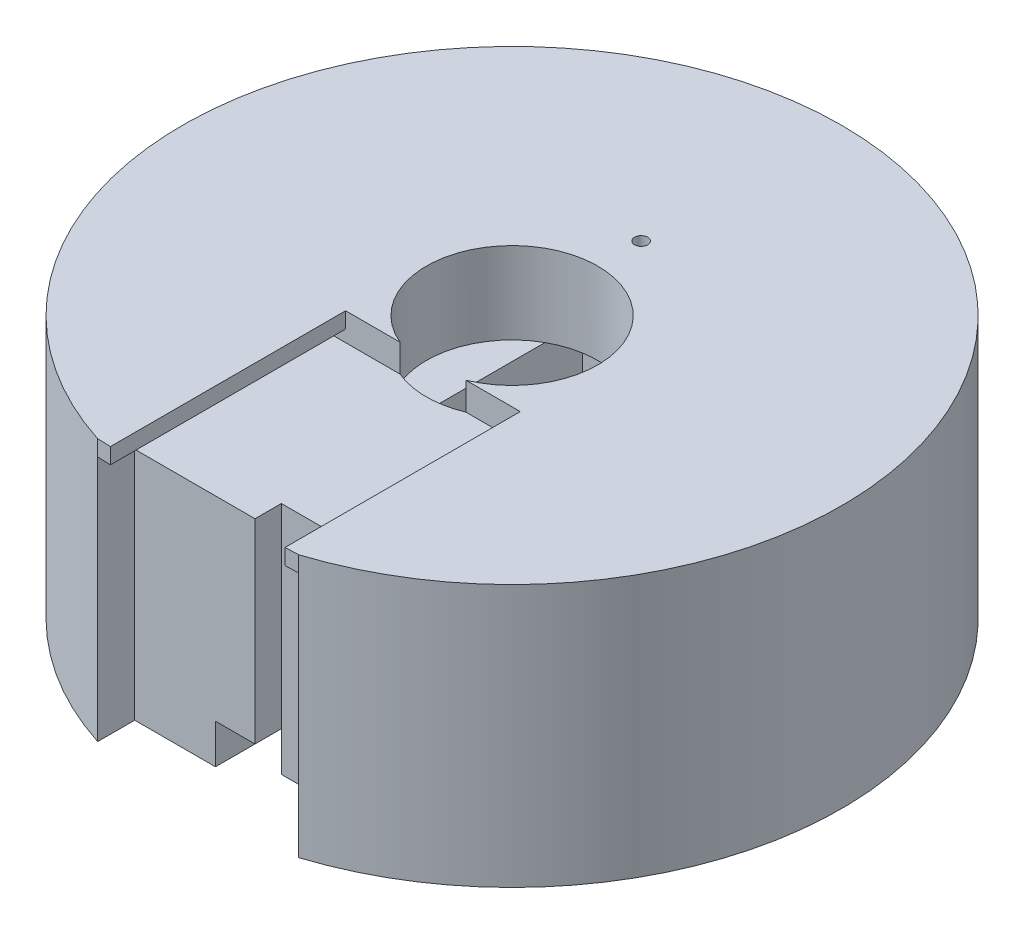
from build123d import *
from build123d.topology import SkipClean

# Parameters (mm, degrees)
SKETCH7_R            = 50
SKETCH7_W            = 12.7
SKETCH7_H            = 33.05
BOSS_EXTRUDE4_DEPTH  = 19.2
SKETCH8_R            = 50
SKETCH8_W            = 12.7
SKETCH8_H            = 23.2
BOSS_EXTRUDE5_DEPTH  = 8.2
SKETCH11_R           = 50
SKETCH11_R_2         = 13
BOSS_EXTRUDE6_DEPTH  = 8.2
SKETCH12_R           = 1
CUT_EXTRUDE4_DEPTH   = 74.271003815
SKETCH13_W           = 30.5
SKETCH13_H           = 8
CUT_EXTRUDE5_DEPTH   = 35.6
CUT_EXTRUDE6_DEPTH   = 6
SKETCH15_W           = 12.25
SKETCH15_H           = 4
CUT_EXTRUDE7_DEPTH   = 29.6
SKETCH16_R           = 1
BOSS_EXTRUDE11_DEPTH = 5.2
CUT_EXTRUDE8_START   = -1
SKETCH20_R           = 50
CUT_EXTRUDE8_DEPTH   = 1
BOSS_EXTRUDE12_DEPTH = 2.4


with BuildPart() as part:
    # Sketch7 → Boss-Extrude4 (new body)
    with BuildSketch(Plane(origin=(0, 0, 0), x_dir=(1, 0, 0), z_dir=(0, 1, 0))):
        with Locations(Location((0, 0, 0), (0, 0, 270))):
            Circle(SKETCH7_R)
        with Locations((0, 5.455)):
            Rectangle(SKETCH7_W, SKETCH7_H, mode=Mode.SUBTRACT)
    extrude(amount=BOSS_EXTRUDE4_DEPTH)

    # Sketch8 → Boss-Extrude5 (add)
    with BuildSketch(Plane(origin=(0, 19.2, 0), x_dir=(1, 0, 0), z_dir=(0, 1, 0))):
        with Locations(Location((0, 0, 0), (0, 0, 270))):
            Circle(SKETCH8_R)
        with Locations((0, 5.455)):
            Rectangle(SKETCH8_W, SKETCH8_H, mode=Mode.SUBTRACT)
    extrude(amount=BOSS_EXTRUDE5_DEPTH)

    # Sketch11 → Boss-Extrude6 (add)
    with BuildSketch(Plane(origin=(0, 27.4, 0), x_dir=(1, 0, 0), z_dir=(0, 1, 0))):
        with Locations(Location((0, 0, 0), (0, 0, 270))):
            Circle(SKETCH11_R)
        with Locations(Location((0, 0, 0), (0, 0, 119.239513028))):
            Circle(SKETCH11_R_2, mode=Mode.SUBTRACT)
    extrude(amount=BOSS_EXTRUDE6_DEPTH)

    # Sketch12 → Cut-Extrude4 (cut, through all)
    with BuildSketch(Plane.XZ.offset(-19.2)):
        with Locations(Location((0, 8.67, 0), (0, 0, 270))):
            Circle(SKETCH12_R)
        with Locations(Location((0, -19.58, 0), (0, 0, 270))):
            Circle(SKETCH12_R)
    extrude(amount=-CUT_EXTRUDE4_DEPTH, mode=Mode.SUBTRACT)

    # Sketch13 → Cut-Extrude5 (cut)
    with BuildSketch(Plane.XZ):
        with Locations((0, 46)):
            Rectangle(SKETCH13_W, SKETCH13_H)
    extrude(amount=-CUT_EXTRUDE5_DEPTH, mode=Mode.SUBTRACT)

    # Sketch14 → Cut-Extrude6 (cut)
    with BuildSketch(Plane.XZ):
        Polygon((-3, 11.07), (3, 11.07), (3, 38), (15.25, 38), (15.25, 42), (3, 42), (-3, 42), align=None)
    extrude(amount=-CUT_EXTRUDE6_DEPTH, mode=Mode.SUBTRACT)

    # Sketch15 → Cut-Extrude7 (cut)
    with BuildSketch(Plane.XZ.offset(-6)):
        with Locations((9.125, 40)):
            Rectangle(SKETCH15_W, SKETCH15_H)
    extrude(amount=-CUT_EXTRUDE7_DEPTH, mode=Mode.SUBTRACT)

    # Sketch16 → Boss-Extrude11 (add)
    with BuildSketch(Plane(origin=(0, 35.6, 0), x_dir=(1, 0, 0), z_dir=(0, 1, 0))):
        with BuildLine():
            ThreePointArc((15.25, -47.617617538), (0, 50), (-15.25, -47.617617538))
            Line((-15.25, -47.617617538), (-15.25, -42))
            Line((-15.25, -42), (-15.25, -12))
            Line((-15.25, -12), (-5, -12))
            ThreePointArc((-5, -12), (-7.211102551, 10.816653826), (13, 0))
            ThreePointArc((13, 0), (10.816653826, -7.211102551), (5, -12))
            Line((5, -12), (15.25, -12))
            Line((15.25, -12), (15.25, -38))
            Line((15.25, -38), (15.25, -47.617617538))
        make_face()
        with Locations(Location((0, 19.58, 0), (0, 0, 90))):
            Circle(SKETCH16_R, mode=Mode.SUBTRACT)
    extrude(amount=BOSS_EXTRUDE11_DEPTH)

    # Sketch20 → Cut-Extrude8 (cut)
    with SkipClean():  # the faces are left unmerged after this step: merging them gives an invalid solid
        with BuildSketch(Plane(origin=(0, 40.8, 0), x_dir=(1, 0, 0), z_dir=(0, 1, 0)).offset(CUT_EXTRUDE8_START)):
            Circle(SKETCH20_R)
        extrude(amount=CUT_EXTRUDE8_DEPTH, mode=Mode.SUBTRACT)

    # Sketch21 → Boss-Extrude12 (add)
    with SkipClean():  # the faces are left unmerged after this step: merging them gives an invalid solid
        with BuildSketch(Plane(origin=(0, 39.8, 0), x_dir=(1, 0, 0), z_dir=(0, 1, 0))):
            Polygon((-15.25, -12), (-13.25, -12), (-13.25, -47.685588874), (-15.25, -47.617617538), align=None)
            Polygon((13.25, -47.685588874), (15.25, -47.617617538), (15.25, -12), (13.25, -12), align=None)
        extrude(amount=-BOSS_EXTRUDE12_DEPTH)


solid = part.part
